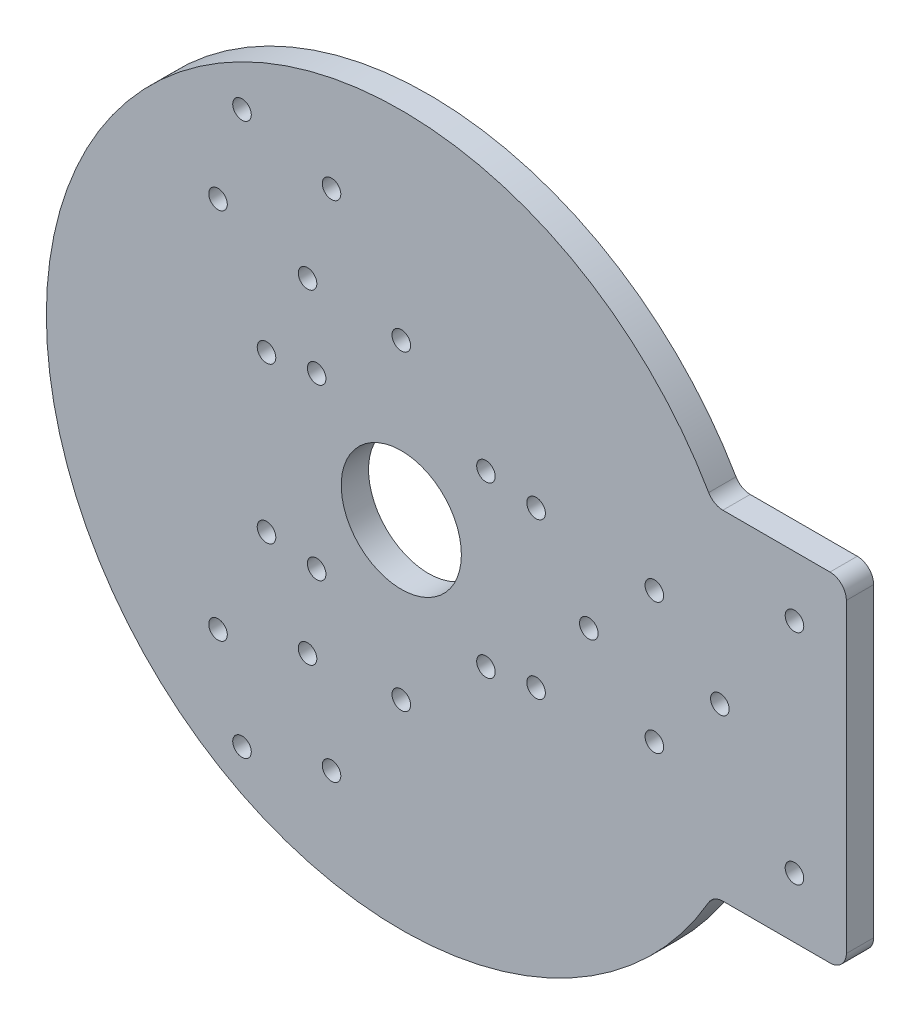
from build123d import *

# Parameters (mm, degrees)
EXTRUDE_1_DEPTH          = 5
SKETCH_2_R               = 1.7
CUT_EXTRUDE_1_DEPTH      = 5
PATTERN_CIRCULAR_1_COUNT = 3
SKETCH_3_R               = 11
SKETCH_3_R_2             = 1.7
CUT_EXTRUDE_2_DEPTH      = 10
SKETCH_4_R               = 1.7
CUT_EXTRUDE_3_DEPTH      = 10


with BuildPart() as part:
    # 草图1 → 凸台-拉伸1 (new body)
    with BuildSketch(Plane.XY):
        with BuildLine():
            Line((81.5, -28), (81.5, 28))
            ThreePointArc((81.5, 28), (80.621320344, 30.121320344), (78.5, 31))
            Line((78.5, 31), (58.889727457, 31))
            ThreePointArc((58.889727457, 31), (57.389727457, 31.401923789), (56.291651246, 32.5))
            ThreePointArc((56.291651246, 32.5), (-65, 0), (56.291651246, -32.5))
            ThreePointArc((56.291651246, -32.5), (57.389727457, -31.401923789), (58.889727457, -31))
            Line((58.889727457, -31), (78.5, -31))
            ThreePointArc((78.5, -31), (80.621320344, -30.121320344), (81.5, -28))
        make_face()
    extrude(amount=EXTRUDE_1_DEPTH)

    # 草图2 → 切除-拉伸1 (cut)
    with BuildSketch(Plane.XY.offset(5)):
        with Locations((58.34, 0)):
            Circle(SKETCH_2_R)
        with Locations((46.34, -12)):
            Circle(SKETCH_2_R)
        with Locations((34.34, 0)):
            Circle(SKETCH_2_R)
        with Locations((46.34, 12)):
            Circle(SKETCH_2_R)
    cut_extrude_1 = extrude(amount=-CUT_EXTRUDE_1_DEPTH, mode=Mode.SUBTRACT)

    # 阵列(圆周)1: 切除-拉伸1 ×3 about axis
    pattern_circular_1_axis = Axis((0, 0, 0), (0, 0, 1))
    for i in range(1, PATTERN_CIRCULAR_1_COUNT):
        add(cut_extrude_1.rotate(pattern_circular_1_axis, i * 360 / PATTERN_CIRCULAR_1_COUNT), mode=Mode.SUBTRACT)

    # 草图3 → 切除-拉伸2 (cut)
    with BuildSketch(Plane.XY.offset(5)):
        Circle(SKETCH_3_R)
        with Locations((15.5, -15.5)):
            Circle(SKETCH_3_R_2)
        with Locations((15.5, 15.5)):
            Circle(SKETCH_3_R_2)
        with Locations((-15.5, 15.5)):
            Circle(SKETCH_3_R_2)
        with Locations((-15.5, -15.5)):
            Circle(SKETCH_3_R_2)
        with Locations((72, 20)):
            Circle(SKETCH_3_R_2)
        with Locations((72, -20)):
            Circle(SKETCH_3_R_2)
    extrude(amount=-CUT_EXTRUDE_2_DEPTH, mode=Mode.SUBTRACT)

    # 草图4 → 切除-拉伸3 (cut)
    with BuildSketch(Plane.XY.offset(5)):
        with Locations((0, 28.5)):
            Circle(SKETCH_4_R)
        with Locations((24.681724008, 14.25)):
            Circle(SKETCH_4_R)
        with Locations((24.681724008, -14.25)):
            Circle(SKETCH_4_R)
        with Locations((0, -28.5)):
            Circle(SKETCH_4_R)
        with Locations((-24.681724008, -14.25)):
            Circle(SKETCH_4_R)
        with Locations((-24.681724008, 14.25)):
            Circle(SKETCH_4_R)
    extrude(amount=-CUT_EXTRUDE_3_DEPTH, mode=Mode.SUBTRACT)


solid = part.part
